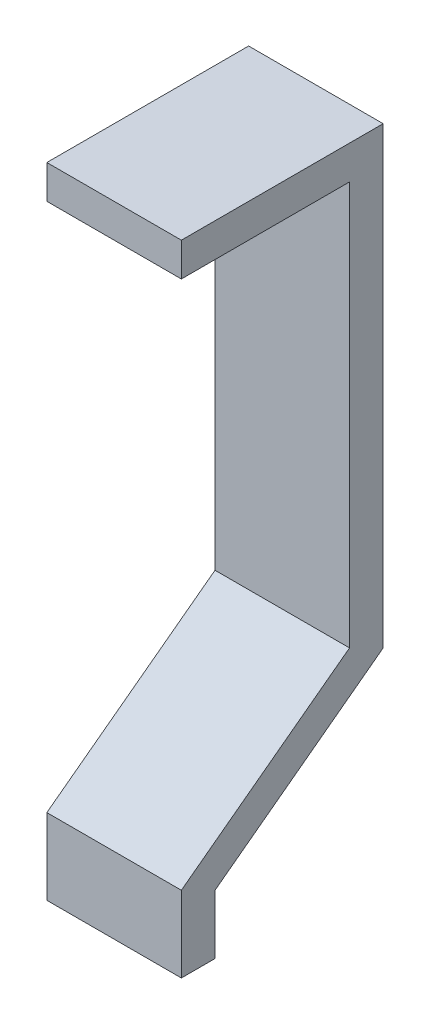
from build123d import *

# Parameters (mm, degrees)
BOSS_EXTRUDE1_DEPTH = 40


with BuildPart() as part:
    # Sketch1 → Boss-Extrude1 (new body)
    with BuildSketch(Plane(origin=(0, 0, 0), x_dir=(0, 0, -1), z_dir=(1, 0, 0))):
        Polygon((-10, 190), (50, 190), (50, 54.99210084), (0, 17.590715743), (0, 0), (-10, 0), (-10, 22.598614903), (40, 60), (40, 180), (-10, 180), align=None)
    extrude(amount=BOSS_EXTRUDE1_DEPTH)


solid = part.part
